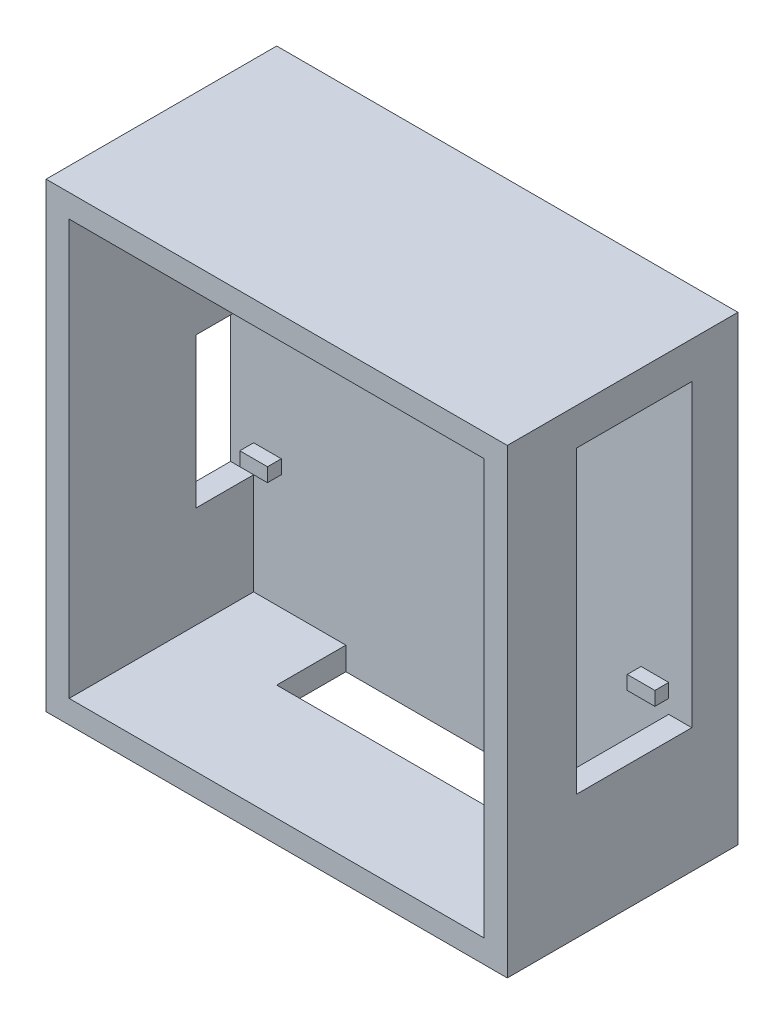
from build123d import *

# Parameters (mm, degrees)
SKETCH1_W               = 100
SKETCH1_H               = 100
BOSS_EXTRUDE1_DEPTH     = 50
SHELL1_T                = -10
CUT_EXTRUDE1_DEPTH      = 151
CUT_EXTRUDE1_DEPTH_BACK = 10
SKETCH2_W               = 50
SKETCH2_H               = 15
SKETCH3_W               = 25
SKETCH3_H               = 65
CUT_EXTRUDE2_DEPTH      = 10
SKETCH4_W               = 12.5
SKETCH4_H               = 32.5
CUT_EXTRUDE3_DEPTH      = 10
CUT_EXTRUDE4_START      = -40
SKETCH5_W               = 90
SKETCH5_H               = 90
CUT_EXTRUDE4_DEPTH      = 40
SKETCH6_W               = 6
SKETCH6_H               = 3
BOSS_EXTRUDE2_DEPTH     = 3


with BuildPart() as part:
    # Sketch1 → Boss-Extrude1 (new body)
    with BuildSketch(Plane.XY):
        with Locations((50, 50)):
            Rectangle(SKETCH1_W, SKETCH1_H)
    extrude(amount=BOSS_EXTRUDE1_DEPTH)

    # Shell1
    shell1_openings = [part.faces().sort_by_distance(p)[0] for p in [
        (50, 50, 50),
    ]]
    offset(amount=SHELL1_T, openings=shell1_openings, kind=Kind.INTERSECTION)

    # Sketch2 → Cut-Extrude1 (cut, two sides: drawn at the far end of the back side and taken through both)
    with BuildSketch(Plane.XZ.offset(-CUT_EXTRUDE1_DEPTH_BACK)):
        with Locations((50, 17.5)):
            Rectangle(SKETCH2_W, SKETCH2_H)
    extrude(amount=CUT_EXTRUDE1_DEPTH + CUT_EXTRUDE1_DEPTH_BACK, mode=Mode.SUBTRACT)

    # Sketch3 → Cut-Extrude2 (cut)
    with BuildSketch(Plane.ZY.offset(-100)):
        with Locations((22.5, 59.5)):
            Rectangle(SKETCH3_W, SKETCH3_H)
    extrude(amount=CUT_EXTRUDE2_DEPTH, mode=Mode.SUBTRACT)

    # Sketch4 → Cut-Extrude3 (cut)
    with BuildSketch(Plane(origin=(0, 0, 0), x_dir=(0, 0, -1), z_dir=(1, 0, 0))):
        with Locations((-16.25, 43.25)):
            Rectangle(SKETCH4_W, SKETCH4_H)
    extrude(amount=CUT_EXTRUDE3_DEPTH, mode=Mode.SUBTRACT)

    # Sketch5 → Cut-Extrude4 (cut)
    with BuildSketch(Plane.XY.offset(50).offset(CUT_EXTRUDE4_START)):
        with Locations((50, 50)):
            Rectangle(SKETCH5_W, SKETCH5_H)
    extrude(amount=CUT_EXTRUDE4_DEPTH, mode=Mode.SUBTRACT)

    # Sketch6 → Boss-Extrude2 (add)
    with BuildSketch(Plane.XY.offset(10)):
        with Locations((8, 31.5)):
            Rectangle(SKETCH6_W, SKETCH6_H)
        with Locations((92, 31.5)):
            Rectangle(SKETCH6_W, SKETCH6_H)
    extrude(amount=BOSS_EXTRUDE2_DEPTH)


solid = part.part
